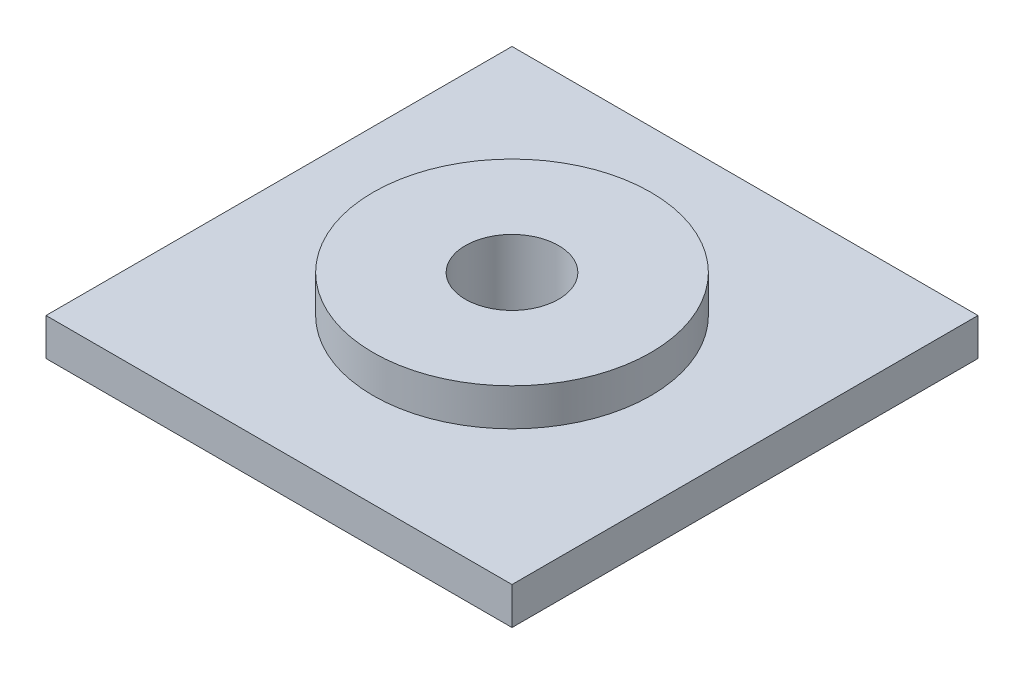
from build123d import *

# Parameters (mm, degrees)
SKETCH1_W           = 25
SKETCH1_H           = 25
BOSS_EXTRUDE1_DEPTH = 2
SKETCH2_R           = 7.45
BOSS_EXTRUDE2_DEPTH = 2
SKETCH3_R           = 2.5
CUT_EXTRUDE1_DEPTH  = 19.12456896
CUT_EXTRUDE2_DEPTH  = 1


with BuildPart() as part:
    # Sketch1 → Boss-Extrude1 (new body)
    with BuildSketch(Plane(origin=(0, 0, 0), x_dir=(1, 0, 0), z_dir=(0, 1, 0))):
        Rectangle(SKETCH1_W, SKETCH1_H)
    extrude(amount=BOSS_EXTRUDE1_DEPTH)

    # Sketch2 → Boss-Extrude2 (add)
    with BuildSketch(Plane(origin=(0, 2, 0), x_dir=(1, 0, 0), z_dir=(0, 1, 0))):
        with Locations(Location((0, 0, 0), (0, 0, 90))):
            Circle(SKETCH2_R)
    extrude(amount=BOSS_EXTRUDE2_DEPTH)

    # Sketch3 → Cut-Extrude1 (cut, through all)
    with BuildSketch(Plane(origin=(0, 4, 0), x_dir=(1, 0, 0), z_dir=(0, 1, 0))):
        with Locations(Location((0, 0, 0), (0, 0, 270))):
            Circle(SKETCH3_R)
    extrude(amount=-CUT_EXTRUDE1_DEPTH, mode=Mode.SUBTRACT)

    # Sketch4 → Cut-Extrude2 (cut)
    with BuildSketch(Plane(origin=(0, 0, 0), x_dir=(1, 0, 0), z_dir=(0, 1, 0))):
        with BuildLine():
            Line((-2.333333333, 7.557692308), (-2.961538462, 7.557692308))
            Line((-2.961538462, 7.557692308), (-2.961538462, 7.252003205))
            add(Edge.make_bspline(
                [(-2.961538462, 7.252003205), (-2.989480706, 7.28020496), (-3.04449669, 7.335731898), (-3.135668937, 7.407116768), (-3.230770823, 7.468159651), (-3.330954831, 7.517577707), (-3.435975916, 7.555311961), (-3.545336332, 7.582963067), (-3.659597801, 7.599276353), (-3.737394418, 7.601456038), (-3.776943109, 7.602564103)],
                knots=[0, 0, 0, 0, 1.041528618, 2.050684245, 3.032913108, 4.004406485, 4.976926473, 5.95771665, 6.961784757, 8, 8, 8, 8], degree=3))
            add(Edge.make_bspline(
                [(-3.776943109, 7.602564103), (-3.816544018, 7.601318478), (-3.894497127, 7.598866505), (-4.008230171, 7.57642866), (-4.115974059, 7.539974743), (-4.216543354, 7.488014163), (-4.310664913, 7.423845548), (-4.394169089, 7.344153745), (-4.469332882, 7.252111111), (-4.509398078, 7.182525891), (-4.529947917, 7.146834936)],
                knots=[0, 0, 0, 0, 1.023965777, 2.015643508, 2.987309376, 3.958410333, 4.93654923, 5.924956801, 6.93568961, 8, 8, 8, 8], degree=3))
            add(Edge.make_bspline(
                [(-4.529947917, 7.146834936), (-4.556418765, 7.182622984), (-4.608373611, 7.252864879), (-4.700468309, 7.344573637), (-4.800050153, 7.423853858), (-4.909045825, 7.488487901), (-5.024560775, 7.539797384), (-5.146089526, 7.576293213), (-5.272530257, 7.598829005), (-5.358580113, 7.601308727), (-5.402143429, 7.602564103)],
                knots=[0, 0, 0, 0, 1.041189987, 2.043563759, 3.033412161, 4.015238574, 5.00275396, 5.986226558, 6.980513695, 8, 8, 8, 8], degree=3))
            add(Edge.make_bspline(
                [(-5.402143429, 7.602564103), (-5.447139162, 7.601260589), (-5.534764169, 7.598722116), (-5.661745387, 7.573747991), (-5.780678663, 7.535159221), (-5.888935605, 7.479003117), (-5.986824974, 7.412483987), (-6.070238525, 7.333888859), (-6.139464151, 7.245960253), (-6.18453891, 7.163856389), (-6.213678531, 7.091267172), (-6.231273293, 7.028100951), (-6.247729839, 6.957567877), (-6.259552221, 6.878719886), (-6.270587893, 6.792298087), (-6.276994534, 6.697727919), (-6.281349194, 6.595327968), (-6.281811715, 6.524477999), (-6.282051282, 6.487780449)],
                knots=[0, 0, 0, 0, 1.321991808, 2.574456155, 3.791773975, 4.987670122, 6.148905103, 7.262530793, 8.344737981, 9.427709016, 10.004683293, 10.642050061, 11.354108788, 12.133887687, 12.985666279, 13.916212488, 14.92067847, 16, 16, 16, 16], degree=3))
            Line((-6.282051282, 6.487780449), (-6.282051282, 5))
            Line((-6.282051282, 5), (-5.653846154, 5))
            Line((-5.653846154, 5), (-5.653846154, 6.284455128))
            add(Edge.make_bspline(
                [(-5.653846154, 6.284455128), (-5.653323292, 6.318811915), (-5.652319706, 6.384756664), (-5.648053076, 6.479341815), (-5.638502531, 6.565122385), (-5.62730807, 6.642573517), (-5.611288579, 6.711284558), (-5.59175572, 6.771421143), (-5.569097721, 6.823069838), (-5.54173887, 6.866225258), (-5.511096925, 6.902568939), (-5.477012182, 6.93372267), (-5.439840026, 6.960302968), (-5.399243437, 6.982958895), (-5.354158888, 6.998281547), (-5.306108363, 7.010304246), (-5.254715851, 7.01849179), (-5.21918308, 7.018979908), (-5.200921474, 7.019230769)],
                knots=[0, 0, 0, 0, 1.669139205, 3.203761885, 4.596586177, 5.860166715, 7.002923539, 8.018877315, 8.928339525, 9.734594377, 10.491888885, 11.231098709, 11.971440889, 12.708030942, 13.480072485, 14.275788656, 15.113863979, 16, 16, 16, 16], degree=3))
            add(Edge.make_bspline(
                [(-5.200921474, 7.019230769), (-5.172780598, 7.018257866), (-5.117559728, 7.016348738), (-5.037091666, 6.998104876), (-4.961370627, 6.968278115), (-4.890680293, 6.927701449), (-4.826541763, 6.877021959), (-4.770436784, 6.816911252), (-4.724101897, 6.747022904), (-4.692027758, 6.682180536), (-4.67198545, 6.623550006), (-4.657847424, 6.573337666), (-4.646827394, 6.516554936), (-4.638201938, 6.453776894), (-4.629926819, 6.384648651), (-4.625867092, 6.30925762), (-4.621712753, 6.227708538), (-4.621766834, 6.171347631), (-4.621794872, 6.142127404)],
                knots=[0, 0, 0, 0, 1.129913425, 2.217230253, 3.297175357, 4.391411011, 5.481605898, 6.571841268, 7.681894157, 8.841607612, 9.468549532, 10.170608623, 10.93710061, 11.791434153, 12.717934886, 13.734733707, 14.825576123, 16, 16, 16, 16], degree=3))
            Line((-4.621794872, 6.142127404), (-4.621794872, 5))
            Line((-4.621794872, 5), (-3.993589744, 5))
            Line((-3.993589744, 5), (-3.993589744, 6.226262019))
            add(Edge.make_bspline(
                [(-3.993589744, 6.226262019), (-3.993536999, 6.253609277), (-3.993435536, 6.306216542), (-3.990385764, 6.38218244), (-3.986347269, 6.452326529), (-3.980685769, 6.516844453), (-3.974156345, 6.575655969), (-3.96473288, 6.628439335), (-3.954832661, 6.675485406), (-3.937858601, 6.728928337), (-3.913939968, 6.78815205), (-3.878205181, 6.850955499), (-3.834996943, 6.903538586), (-3.78540734, 6.946310521), (-3.72936896, 6.978899303), (-3.668301431, 7.003141307), (-3.601038705, 7.016226397), (-3.554739542, 7.018208178), (-3.530849359, 7.019230769)],
                knots=[0, 0, 0, 0, 1.256487322, 2.417074606, 3.49288742, 4.484586665, 5.393016842, 6.210437544, 6.947749329, 7.599905853, 8.784490193, 9.876739139, 10.906602197, 11.896672079, 12.869113195, 13.872201355, 14.902064413, 16, 16, 16, 16], degree=3))
            add(Edge.make_bspline(
                [(-3.530849359, 7.019230769), (-3.503855508, 7.018314551), (-3.45039396, 7.016499974), (-3.372519049, 6.997009927), (-3.298063411, 6.967730431), (-3.228664996, 6.92602202), (-3.165492717, 6.874149887), (-3.109949469, 6.812329381), (-3.063858089, 6.740633832), (-3.031641579, 6.674002879), (-3.011891512, 6.613909599), (-2.997373334, 6.562393448), (-2.98676332, 6.504360235), (-2.977910901, 6.440461569), (-2.969684775, 6.370622026), (-2.96560825, 6.294534478), (-2.961458016, 6.212283263), (-2.961511, 6.155455403), (-2.961538462, 6.126001603)],
                knots=[0, 0, 0, 0, 1.07893236, 2.136834559, 3.195274846, 4.273923004, 5.364443877, 6.458052972, 7.587287137, 8.767908, 9.410170275, 10.118584836, 10.909717261, 11.770069756, 12.702352573, 13.724628867, 14.820678298, 16, 16, 16, 16], degree=3))
            Line((-2.961538462, 6.126001603), (-2.961538462, 5))
            Line((-2.961538462, 5), (-2.333333333, 5))
            Line((-2.333333333, 5), (-2.333333333, 7.557692308))
        make_face()
        with BuildLine():
            Line((2.243589744, 7.557692308), (1.615384615, 7.557692308))
            Line((1.615384615, 7.557692308), (1.615384615, 7.252003205))
            add(Edge.make_bspline(
                [(1.615384615, 7.252003205), (1.58744237, 7.28020496), (1.532426387, 7.335731898), (1.44125414, 7.407116768), (1.346152254, 7.468159651), (1.245968246, 7.517577707), (1.140947161, 7.555311961), (1.031586744, 7.582963067), (0.917325276, 7.599276353), (0.839528659, 7.601456038), (0.799979968, 7.602564103)],
                knots=[0, 0, 0, 0, 1.041528618, 2.050684245, 3.032913108, 4.004406485, 4.976926473, 5.95771665, 6.961784757, 8, 8, 8, 8], degree=3))
            add(Edge.make_bspline(
                [(0.799979968, 7.602564103), (0.760379059, 7.601318478), (0.68242595, 7.598866505), (0.568692906, 7.57642866), (0.460949018, 7.539974743), (0.360379723, 7.488014163), (0.266258164, 7.423845548), (0.182753988, 7.344153745), (0.107590195, 7.252111111), (0.067524999, 7.182525891), (0.04697516, 7.146834936)],
                knots=[0, 0, 0, 0, 1.023965777, 2.015643508, 2.987309376, 3.958410333, 4.93654923, 5.924956801, 6.93568961, 8, 8, 8, 8], degree=3))
            add(Edge.make_bspline(
                [(0.04697516, 7.146834936), (0.020504312, 7.182622984), (-0.031450534, 7.252864879), (-0.123545232, 7.344573637), (-0.223127076, 7.423853858), (-0.332122748, 7.488487901), (-0.447637698, 7.539797384), (-0.569166449, 7.576293213), (-0.69560718, 7.598829005), (-0.781657036, 7.601308727), (-0.825220353, 7.602564103)],
                knots=[0, 0, 0, 0, 1.041189987, 2.043563759, 3.033412161, 4.015238574, 5.00275396, 5.986226558, 6.980513695, 8, 8, 8, 8], degree=3))
            add(Edge.make_bspline(
                [(-0.825220353, 7.602564103), (-0.870216085, 7.601260589), (-0.957841092, 7.598722116), (-1.08482231, 7.573747991), (-1.203755586, 7.535159221), (-1.312012529, 7.479003117), (-1.409901897, 7.412483987), (-1.493315448, 7.333888859), (-1.562541074, 7.245960253), (-1.607615833, 7.163856389), (-1.636755454, 7.091267172), (-1.654350216, 7.028100951), (-1.670806762, 6.957567877), (-1.682629144, 6.878719886), (-1.693664816, 6.792298087), (-1.700071457, 6.697727919), (-1.704426118, 6.595327968), (-1.704888638, 6.524477999), (-1.705128205, 6.487780449)],
                knots=[0, 0, 0, 0, 1.321991808, 2.574456155, 3.791773975, 4.987670122, 6.148905103, 7.262530793, 8.344737981, 9.427709016, 10.004683293, 10.642050061, 11.354108788, 12.133887687, 12.985666279, 13.916212488, 14.92067847, 16, 16, 16, 16], degree=3))
            Line((-1.705128205, 6.487780449), (-1.705128205, 5))
            Line((-1.705128205, 5), (-1.076923077, 5))
            Line((-1.076923077, 5), (-1.076923077, 6.284455128))
            add(Edge.make_bspline(
                [(-1.076923077, 6.284455128), (-1.076400215, 6.318811915), (-1.075396629, 6.384756664), (-1.071129999, 6.479341815), (-1.061579455, 6.565122385), (-1.050384993, 6.642573517), (-1.034365502, 6.711284558), (-1.014832643, 6.771421143), (-0.992174644, 6.823069838), (-0.964815793, 6.866225258), (-0.934173848, 6.902568939), (-0.900089105, 6.93372267), (-0.862916949, 6.960302968), (-0.82232036, 6.982958895), (-0.777235811, 6.998281547), (-0.729185286, 7.010304246), (-0.677792774, 7.01849179), (-0.642260003, 7.018979908), (-0.623998397, 7.019230769)],
                knots=[0, 0, 0, 0, 1.669139205, 3.203761885, 4.596586177, 5.860166715, 7.002923539, 8.018877315, 8.928339525, 9.734594377, 10.491888885, 11.231098709, 11.971440889, 12.708030942, 13.480072485, 14.275788656, 15.113863979, 16, 16, 16, 16], degree=3))
            add(Edge.make_bspline(
                [(-0.623998397, 7.019230769), (-0.595857521, 7.018257866), (-0.540636652, 7.016348738), (-0.46016859, 6.998104876), (-0.38444755, 6.968278115), (-0.313757216, 6.927701449), (-0.249618686, 6.877021959), (-0.193513707, 6.816911252), (-0.14717882, 6.747022904), (-0.115104681, 6.682180536), (-0.095062374, 6.623550006), (-0.080924347, 6.573337666), (-0.069904317, 6.516554936), (-0.061278861, 6.453776894), (-0.053003742, 6.384648651), (-0.048944015, 6.30925762), (-0.044789676, 6.227708538), (-0.044843757, 6.171347631), (-0.044871795, 6.142127404)],
                knots=[0, 0, 0, 0, 1.129913425, 2.217230253, 3.297175357, 4.391411011, 5.481605898, 6.571841268, 7.681894157, 8.841607612, 9.468549532, 10.170608623, 10.93710061, 11.791434153, 12.717934886, 13.734733707, 14.825576123, 16, 16, 16, 16], degree=3))
            Line((-0.044871795, 6.142127404), (-0.044871795, 5))
            Line((-0.044871795, 5), (0.583333333, 5))
            Line((0.583333333, 5), (0.583333333, 6.226262019))
            add(Edge.make_bspline(
                [(0.583333333, 6.226262019), (0.583386078, 6.253609277), (0.583487541, 6.306216542), (0.586537313, 6.38218244), (0.590575808, 6.452326529), (0.596237308, 6.516844453), (0.602766732, 6.575655969), (0.612190197, 6.628439335), (0.622090416, 6.675485406), (0.639064476, 6.728928337), (0.662983109, 6.78815205), (0.698717896, 6.850955499), (0.741926134, 6.903538586), (0.791515737, 6.946310521), (0.847554117, 6.978899303), (0.908621646, 7.003141307), (0.975884372, 7.016226397), (1.022183535, 7.018208178), (1.046073718, 7.019230769)],
                knots=[0, 0, 0, 0, 1.256487322, 2.417074606, 3.49288742, 4.484586665, 5.393016842, 6.210437544, 6.947749329, 7.599905853, 8.784490193, 9.876739139, 10.906602197, 11.896672079, 12.869113195, 13.872201355, 14.902064413, 16, 16, 16, 16], degree=3))
            add(Edge.make_bspline(
                [(1.046073718, 7.019230769), (1.073067569, 7.018314551), (1.126529117, 7.016499974), (1.204404028, 6.997009927), (1.278859666, 6.967730431), (1.348258081, 6.92602202), (1.41143036, 6.874149887), (1.466973608, 6.812329381), (1.513064988, 6.740633832), (1.545281498, 6.674002879), (1.565031565, 6.613909599), (1.579549743, 6.562393448), (1.590159757, 6.504360235), (1.599012175, 6.440461569), (1.607238302, 6.370622026), (1.611314827, 6.294534478), (1.615465061, 6.212283263), (1.615412077, 6.155455403), (1.615384615, 6.126001603)],
                knots=[0, 0, 0, 0, 1.07893236, 2.136834559, 3.195274846, 4.273923004, 5.364443877, 6.458052972, 7.587287137, 8.767908, 9.410170275, 10.118584836, 10.909717261, 11.770069756, 12.702352573, 13.724628867, 14.820678298, 16, 16, 16, 16], degree=3))
            Line((1.615384615, 6.126001603), (1.615384615, 5))
            Line((1.615384615, 5), (2.243589744, 5))
            Line((2.243589744, 5), (2.243589744, 7.557692308))
        make_face()
        with BuildLine():
            Line((5.811598558, 8.5), (4.217948718, 8.5))
            Line((4.217948718, 8.5), (4.217948718, 7.916666667))
            Line((4.217948718, 7.916666667), (5.313802083, 7.916666667))
            Line((5.313802083, 7.916666667), (5.450520833, 7.254807692))
            add(Edge.make_bspline(
                [(5.450520833, 7.254807692), (5.431890947, 7.259996351), (5.395148982, 7.270229452), (5.339797167, 7.280491957), (5.286153545, 7.287143787), (5.250952927, 7.288031053), (5.233874199, 7.288461538)],
                knots=[0, 0, 0, 0, 1.05461699, 2.079921384, 3.068411212, 4, 4, 4, 4], degree=3))
            add(Edge.make_bspline(
                [(5.233874199, 7.288461538), (5.196657861, 7.287608748), (5.123296261, 7.285927709), (5.015977549, 7.26996917), (4.913213542, 7.244834954), (4.81531871, 7.208988378), (4.722388683, 7.162333132), (4.634310812, 7.105893363), (4.550976994, 7.039569942), (4.473867591, 6.963321345), (4.40301625, 6.879598659), (4.341415051, 6.789043716), (4.288803782, 6.69294774), (4.246958598, 6.590713401), (4.213930811, 6.4829828), (4.190064195, 6.3696869), (4.175950672, 6.250691427), (4.17404755, 6.169509324), (4.173076923, 6.128104968)],
                knots=[0, 0, 0, 0, 1.01440847, 1.999622559, 2.951875003, 3.895578053, 4.836219714, 5.782137149, 6.743708247, 7.735272588, 8.734977101, 9.730283169, 10.717124674, 11.717316708, 12.737475749, 13.78628267, 14.87096371, 16, 16, 16, 16], degree=3))
            add(Edge.make_bspline(
                [(4.173076923, 6.128104968), (4.174263045, 6.086230577), (4.17660361, 6.003600162), (4.191873652, 5.882104224), (4.21882555, 5.765738544), (4.255846678, 5.654191613), (4.304619646, 5.548283274), (4.363275814, 5.446916397), (4.432806901, 5.350843395), (4.512530568, 5.261049133), (4.599200653, 5.178975454), (4.691483833, 5.106775081), (4.788731793, 5.046019052), (4.890946878, 4.996917909), (4.997542649, 4.958069959), (5.108551458, 4.929790505), (5.224512793, 4.91357381), (5.303235473, 4.911374362), (5.343249199, 4.91025641)],
                knots=[0, 0, 0, 0, 1.06808661, 2.107647099, 3.116961351, 4.110378221, 5.100014249, 6.085620622, 7.093190682, 8.119403071, 9.144090782, 10.133780668, 11.103064255, 12.062861538, 13.020824475, 13.992378307, 14.979551724, 16, 16, 16, 16], degree=3))
            add(Edge.make_bspline(
                [(5.343249199, 4.91025641), (5.379032282, 4.911170964), (5.449604011, 4.912974655), (5.55355307, 4.924061093), (5.653771506, 4.943662018), (5.749727269, 4.972029632), (5.842429974, 5.006943689), (5.93080795, 5.050610316), (6.015346851, 5.10219804), (6.095806618, 5.160765386), (6.170879894, 5.226739229), (6.239398825, 5.298958967), (6.301778234, 5.376514305), (6.356683299, 5.460362042), (6.403941909, 5.550378295), (6.445851809, 5.645502204), (6.480155481, 5.746727166), (6.497563607, 5.816901933), (6.506410256, 5.852564103)],
                knots=[0, 0, 0, 0, 1.054957082, 2.080596141, 3.077793124, 4.061112343, 5.027190972, 5.994718051, 6.962465889, 7.943658696, 8.924948258, 9.904494768, 10.875059, 11.855380583, 12.854004648, 13.869083016, 14.917087635, 16, 16, 16, 16], degree=3))
            Line((6.506410256, 5.852564103), (5.788461538, 5.852564103))
            add(Edge.make_bspline(
                [(5.788461538, 5.852564103), (5.775337419, 5.827851671), (5.749832189, 5.779825881), (5.701315604, 5.716064428), (5.647004368, 5.661691401), (5.587388397, 5.616175562), (5.522081416, 5.58207587), (5.453744562, 5.556216242), (5.381519349, 5.54127292), (5.332330789, 5.539404857), (5.307491987, 5.538461538)],
                knots=[0, 0, 0, 0, 1.104910296, 2.147267069, 3.153527244, 4.136738762, 5.099945312, 6.05603338, 7.018353, 8, 8, 8, 8], degree=3))
            add(Edge.make_bspline(
                [(5.307491987, 5.538461538), (5.290179675, 5.539112908), (5.25611741, 5.540394488), (5.205932049, 5.547174369), (5.158027917, 5.560015309), (5.112048858, 5.577797026), (5.067871361, 5.599972835), (5.026128726, 5.62796835), (4.986094706, 5.660192225), (4.94837878, 5.697169231), (4.914219023, 5.738389992), (4.884264653, 5.782684509), (4.857481315, 5.829068549), (4.837642487, 5.879379501), (4.821396165, 5.932115061), (4.809431716, 5.98767303), (4.802281608, 6.046118294), (4.801619699, 6.086017238), (4.801282051, 6.106370192)],
                knots=[0, 0, 0, 0, 0.978869489, 1.925942215, 2.855067702, 3.774946051, 4.70828698, 5.642468714, 6.60995405, 7.609372294, 8.622401667, 9.629904756, 10.629323, 11.642352373, 12.678539694, 13.745912462, 14.850161547, 16, 16, 16, 16], degree=3))
            add(Edge.make_bspline(
                [(4.801282051, 6.106370192), (4.801673931, 6.126250708), (4.802436734, 6.164948615), (4.808746793, 6.221771003), (4.820035366, 6.275685166), (4.835416145, 6.327104046), (4.855105377, 6.375715402), (4.879166936, 6.421808594), (4.907703613, 6.465150636), (4.940868618, 6.504859127), (4.976235437, 6.541280884), (5.014230765, 6.573135063), (5.054512285, 6.59957182), (5.095828297, 6.622651878), (5.139827988, 6.639449041), (5.185521983, 6.651016627), (5.232862226, 6.659504457), (5.265151979, 6.660003148), (5.281550481, 6.66025641)],
                knots=[0, 0, 0, 0, 1.166249705, 2.270133367, 3.348514167, 4.393962215, 5.415026464, 6.420877785, 7.440098956, 8.453121383, 9.451844239, 10.415694839, 11.355045125, 12.27538808, 13.187007209, 14.108269027, 15.039275622, 16, 16, 16, 16], degree=3))
            add(Edge.make_bspline(
                [(5.281550481, 6.66025641), (5.299363064, 6.659580522), (5.335063304, 6.658225896), (5.388104924, 6.647203668), (5.440507009, 6.629365569), (5.49256097, 6.604755084), (5.543750079, 6.572547724), (5.595425244, 6.534772184), (5.645856785, 6.488683712), (5.677922562, 6.454356913), (5.694511218, 6.436598558)],
                knots=[0, 0, 0, 0, 0.88288272, 1.769486374, 2.674910571, 3.623812639, 4.617874466, 5.670434592, 6.794841017, 8, 8, 8, 8], degree=3))
            Line((5.694511218, 6.436598558), (6.223157051, 6.557892628))
            Line((6.223157051, 6.557892628), (5.811598558, 8.5))
        make_face()
    extrude(amount=CUT_EXTRUDE2_DEPTH, mode=Mode.SUBTRACT)


solid = part.part
